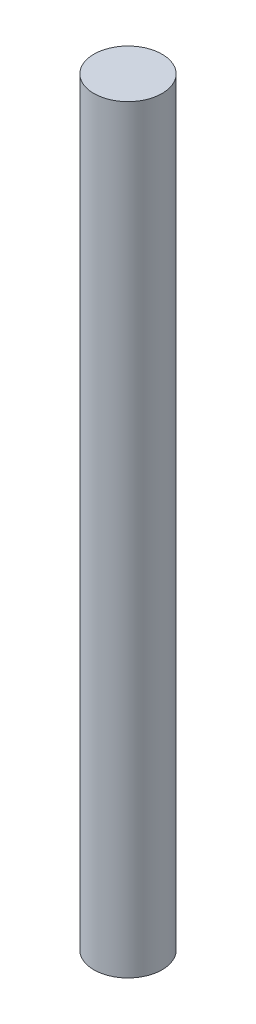
from build123d import *

# Parameters (mm, degrees)
SKETCH_1_R      = 1.5
EXTRUDE_1_DEPTH = 33.4


with BuildPart() as part:
    # 草图1 → 凸台-拉伸1 (new body)
    with BuildSketch(Plane(origin=(0, 0, 0), x_dir=(1, 0, 0), z_dir=(0, 1, 0))):
        with Locations(Location((0, 0, 0), (0, 0, 270))):
            Circle(SKETCH_1_R)
    extrude(amount=EXTRUDE_1_DEPTH)


solid = part.part
